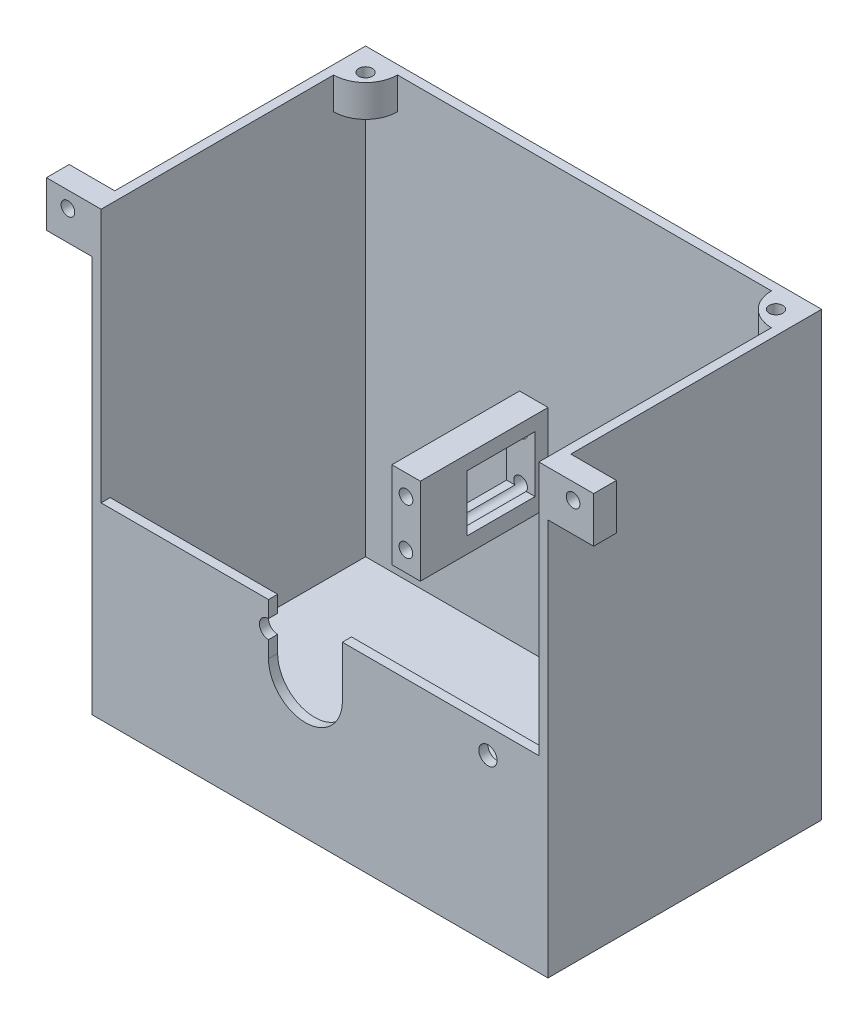
from build123d import *

# Parameters (mm, degrees)
BOSS_EXTRUDE1_DEPTH     = 70
SKETCH2_W               = 100
SKETCH2_H               = 100
BOSS_EXTRUDE2_DEPTH     = 2
SKETCH3_W               = 6.255686465
SKETCH3_H               = 19
SKETCH3_R               = 1.5
SKETCH3_W_2             = 6.249842205
BOSS_EXTRUDE4_DEPTH     = 28
CUT_EXTRUDE2_DEPTH      = 49
CUT_EXTRUDE2_DEPTH_BACK = 10
SKETCH4_W               = 14.879207683
SKETCH4_H               = 12.351519759
SKETCH5_W               = 96.00443459
SKETCH5_H               = 43.693152777
BOSS_EXTRUDE5_DEPTH     = 2
SKETCH9_W               = 100
SKETCH9_H               = 100
CUT_EXTRUDE3_DEPTH      = 42
BOSS_EXTRUDE6_DEPTH     = 2
SKETCH8_R               = 1.5
BOSS_EXTRUDE7_DEPTH     = 10
SKETCH11_W              = 10
SKETCH11_H              = 10
SKETCH11_R              = 1.5
BOSS_EXTRUDE8_DEPTH     = 5
SKETCH13_R              = 2
CUT_EXTRUDE4_DEPTH      = 10
CUT_EXTRUDE5_DEPTH      = 3
SKETCH16_R              = 4.002775558
CUT_EXTRUDE7_DEPTH      = 3


with BuildPart() as part:
    # Sketch1 → Boss-Extrude1 (new body)
    with BuildSketch(Plane.XY):
        Polygon((-47.671840355, 33.254988914), (-47.671840355, 35.254988914), (-49.667405765, 35.254988914), (-49.667405765, -64.745011086), (50.332594235, -64.745011086), (50.332594235, 35.254988914), (48.332594235, 35.254988914), (48.332594235, 33.254988914), (48.332594235, -62.745011086), (-47.671840355, -62.745011086), align=None)
    extrude(amount=BOSS_EXTRUDE1_DEPTH)

    # Sketch2 → Boss-Extrude2 (add)
    with BuildSketch(Plane(origin=(0, 0, 0), x_dir=(-1, 0, 0), z_dir=(0, 0, -1))):
        with Locations((-0.332594235, -14.745011086)):
            Rectangle(SKETCH2_W, SKETCH2_H)
    extrude(amount=BOSS_EXTRUDE2_DEPTH)

    # Sketch3 → Boss-Extrude4 (add)
    # profile 1 of 2: a face of its own
    with BuildSketch(Plane.XY):
        with Locations((37.062045054, -23.882996664)):
            Rectangle(SKETCH3_W, SKETCH3_H)
        with Locations((37.169542955, -19.02966579)):
            Circle(SKETCH3_R, mode=Mode.SUBTRACT)
        with Locations((37.189888286, -28.916071788)):
            Circle(SKETCH3_R, mode=Mode.SUBTRACT)
    # profile 2 of 2: a face of its own
    with BuildSketch(Plane.XY):
        with Locations((-10.777585785, -23.882996664)):
            Rectangle(SKETCH3_W_2, SKETCH3_H)
        with Locations((-10.805764952, -18.882996664)):
            Circle(SKETCH3_R, mode=Mode.SUBTRACT)
        with Locations((-10.830457045, -29.02966579)):
            Circle(SKETCH3_R, mode=Mode.SUBTRACT)
    extrude(amount=BOSS_EXTRUDE4_DEPTH)

    # Sketch4 → Cut-Extrude2 (cut, two sides: drawn at the far end of the back side and taken through both)
    with BuildSketch(Plane.ZY.offset(-33.934201821).offset(-CUT_EXTRUDE2_DEPTH_BACK)):
        with Locations((10.28647213, -23.707236785)):
            Rectangle(SKETCH4_W, SKETCH4_H)
    extrude(amount=CUT_EXTRUDE2_DEPTH + CUT_EXTRUDE2_DEPTH_BACK, mode=Mode.SUBTRACT)

    # Sketch5 → Boss-Extrude5 (add)
    with BuildSketch(Plane.XY.offset(70)):
        with Locations((0.33037694, -40.898434698)):
            Rectangle(SKETCH5_W, SKETCH5_H)
    extrude(amount=-BOSS_EXTRUDE5_DEPTH)

    # Sketch9 → Cut-Extrude3 (cut)
    with BuildSketch(Plane(origin=(0, 0, 58), x_dir=(-1, 0, 0), z_dir=(0, 0, -1))):
        with Locations((-0.332594235, -14.745011086)):
            Rectangle(SKETCH9_W, SKETCH9_H)
    extrude(amount=-CUT_EXTRUDE3_DEPTH, mode=Mode.SUBTRACT)

    # Sketch10 → Boss-Extrude6 (add)
    with BuildSketch(Plane.XY.offset(58)):
        with BuildLine():
            Line((-49.667405765, -64.745011086), (50.332594235, -64.745011086))
            Line((50.332594235, -64.745011086), (50.332594235, -23.515098033))
            Line((50.332594235, -23.515098033), (16.092202794, -23.515098033))
            Line((16.092202794, -23.515098033), (5.242138191, -23.515098033))
            Line((5.242138191, -23.515098033), (5.242138191, -34.745011086))
            ThreePointArc((5.242138191, -34.745011086), (-2.857861809, -42.845011086), (-10.957861809, -34.745011086))
            Line((-10.957861809, -34.745011086), (-10.957861809, -23.515098033))
            Line((-10.957861809, -23.515098033), (-15.769437358, -23.515098033))
            Line((-15.769437358, -23.515098033), (-49.667405765, -23.515098033))
            Line((-49.667405765, -23.515098033), (-49.667405765, -64.745011086))
        make_face()
    extrude(amount=-BOSS_EXTRUDE6_DEPTH)

    # Sketch8 → Boss-Extrude7 (add)
    # profile 1 of 2: a face of its own
    with BuildSketch(Plane(origin=(0, 35.254988914, 0), x_dir=(1, 0, 0), z_dir=(0, 1, 0))):
        with BuildLine():
            Line((-47.671840355, 0), (-40.671840355, 0))
            ThreePointArc((-40.671840355, 0), (-42.722092886, -4.949747468), (-47.671840355, -7))
            Line((-47.671840355, -7), (-47.671840355, 0))
        make_face()
        with Locations(Location((-44.671840355, -3, 0), (0, 0, 270))):
            Circle(SKETCH8_R, mode=Mode.SUBTRACT)
    # profile 2 of 2: a face of its own
    with BuildSketch(Plane(origin=(0, 35.254988914, 0), x_dir=(1, 0, 0), z_dir=(0, 1, 0))):
        with BuildLine():
            Line((48.332594235, 0), (48.332594235, -7))
            ThreePointArc((48.332594235, -7), (43.382846767, -4.949747468), (41.332594235, 0))
            Line((41.332594235, 0), (48.332594235, 0))
        make_face()
        with Locations(Location((45.332594235, -3, 0), (0, 0, 270))):
            Circle(SKETCH8_R, mode=Mode.SUBTRACT)
    extrude(amount=-BOSS_EXTRUDE7_DEPTH)

    # Sketch11 → Boss-Extrude8 (add)
    # profile 1 of 2: a face of its own
    with BuildSketch(Plane.XY.offset(58)):
        with Locations((-54.667405765, 27.254988914)):
            Rectangle(SKETCH11_W, SKETCH11_H)
        with Locations((-54.949444375, 28.754988914)):
            Circle(SKETCH11_R, mode=Mode.SUBTRACT)
    # profile 2 of 2: a face of its own
    with BuildSketch(Plane.XY.offset(58)):
        with Locations((55.332594235, 27.254988914)):
            Rectangle(SKETCH11_W, SKETCH11_H)
        with Locations((55.832594235, 28.754988914)):
            Circle(SKETCH11_R, mode=Mode.SUBTRACT)
    extrude(amount=-BOSS_EXTRUDE8_DEPTH)

    # Sketch13 → Cut-Extrude4 (cut)
    with BuildSketch(Plane.XY.offset(58)):
        with Locations((-10.957861809, -29.13005456)):
            Circle(SKETCH13_R)
        with Locations((37.169542955, -29.02966579)):
            Circle(SKETCH13_R)
    extrude(amount=-CUT_EXTRUDE4_DEPTH, mode=Mode.SUBTRACT)

    # Sketch15 → Cut-Extrude5 (cut)
    with BuildSketch(Plane(origin=(0, 35.254988914, 0), x_dir=(1, 0, 0), z_dir=(0, 1, 0))):
        with BuildLine():
            Line((-47.671840355, -58), (-47.671840355, -7))
            ThreePointArc((-47.671840355, -7), (-42.722092886, -4.949747468), (-40.671840355, 0))
            Line((-40.671840355, 0), (41.332594235, 0))
            ThreePointArc((41.332594235, 0), (43.382846767, -4.949747468), (48.332594235, -7))
            Line((48.332594235, -7), (48.332594235, -58))
            Line((48.332594235, -58), (50.332594235, -58))
            Line((50.332594235, -58), (50.332594235, 2))
            Line((50.332594235, 2), (-49.667405765, 2))
            Line((-49.667405765, 2), (-49.667405765, -58))
            Line((-49.667405765, -58), (-47.671840355, -58))
        make_face()
    extrude(amount=-CUT_EXTRUDE5_DEPTH, mode=Mode.SUBTRACT)

    # Sketch16 → Cut-Extrude7 (cut)
    with BuildSketch(Plane(origin=(0, -62.745011086, 0), x_dir=(1, 0, 0), z_dir=(0, 1, 0))):
        with Locations(Location((44.016753305, -11.905726119, 0), (0, 0, 270))):
            Circle(SKETCH16_R)
    extrude(amount=-CUT_EXTRUDE7_DEPTH, mode=Mode.SUBTRACT)


solid = part.part
